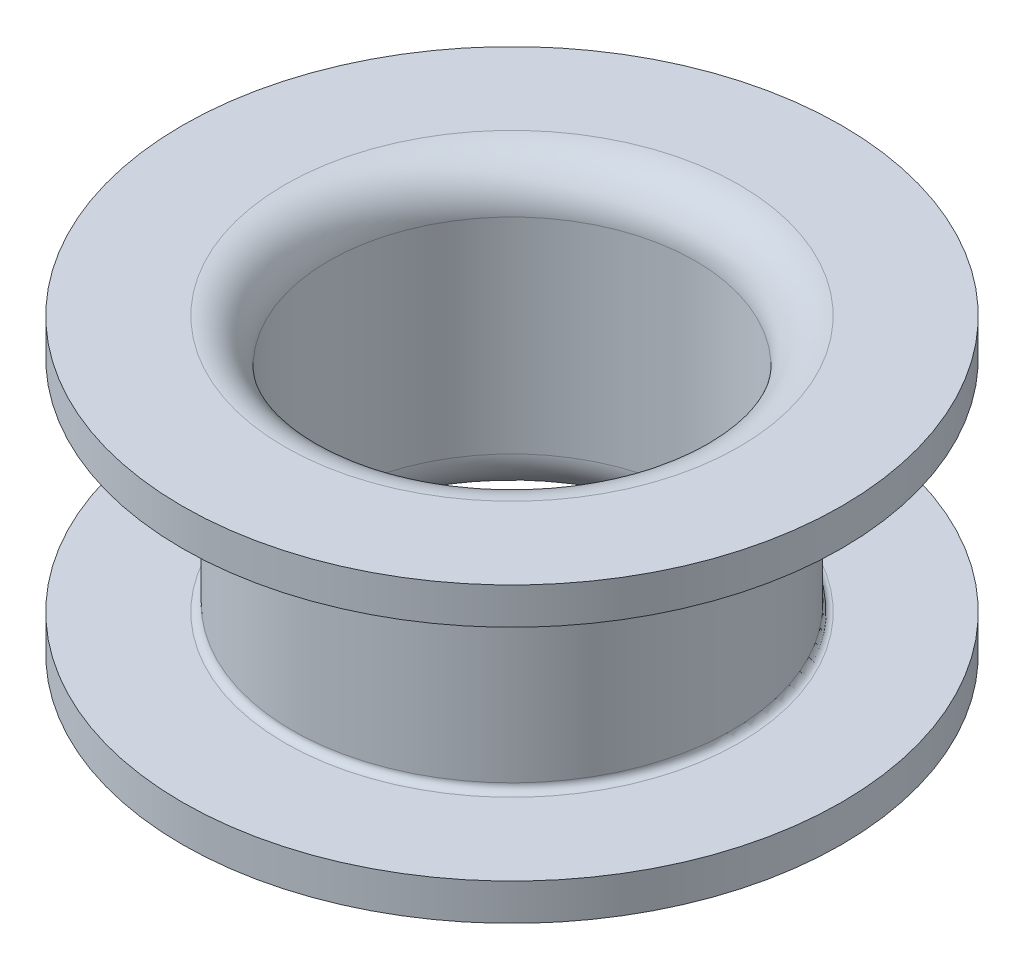
from build123d import *


with BuildPart() as part:
    # Esquisse1 → Base-Révolution (revolve)
    with BuildSketch(Plane.XY, mode=Mode.PRIVATE) as base_r_volution_sk:
        with BuildLine():
            Line((6.2, 0), (9, 0))
            Line((9, 0), (9, 1))
            Line((9, 1), (6.2, 1))
            ThreePointArc((6.2, 1), (6.058578644, 1.058578644), (6, 1.2))
            Line((6, 1.2), (6, 6.8))
            ThreePointArc((6, 6.8), (6.058578644, 6.941421356), (6.2, 7))
            Line((6.2, 7), (9, 7))
            Line((9, 7), (9, 8))
            Line((9, 8), (6.2, 8))
            ThreePointArc((6.2, 8), (5.351471863, 7.648528137), (5, 6.8))
            Line((5, 6.8), (5, 1.2))
            ThreePointArc((5, 1.2), (5.351471863, 0.351471863), (6.2, 0))
        make_face()
    revolve(base_r_volution_sk.sketch.rotate(Axis((0, 0, 0), (0, 1, 0)), 90), axis=Axis((0, 0, 0), (0, 1, 0)))


solid = part.part
